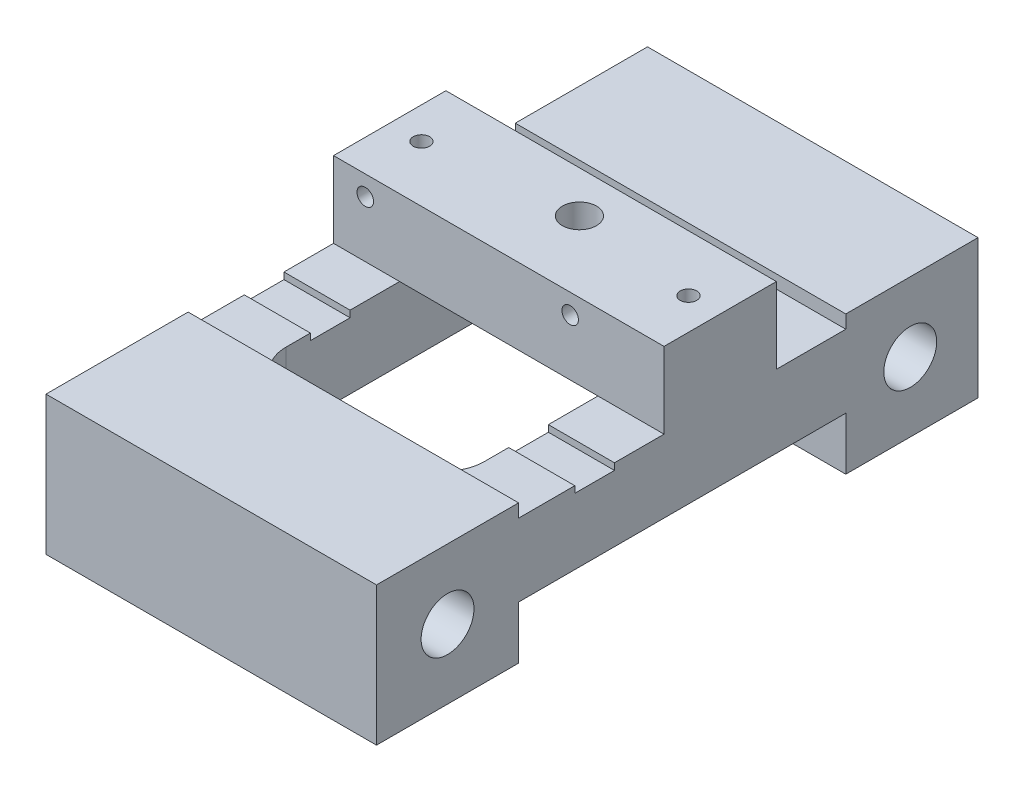
from build123d import *

# Parameters (mm, degrees)
BOSS_EXTRUDE1_DEPTH            = 50
CUT_EXTRUDE1_REACH             = 108.241
M3_TAPPED_HOLE1_D              = 2.5
M3_TAPPED_HOLE2_D              = 2.5
SKETCH7_R                      = 2.577157182
CUT_EXTRUDE2_DEPTH             = 109.218528913
CUT_EXTRUDE3_REACH             = 110.219
SKETCH8_R                      = 4
CUT_EXTRUDE3_DIRECTION_2_DEPTH = 109.218528913


with BuildPart() as part:
    # Sketch1 → Boss-Extrude1 (new body)
    with BuildSketch(Plane(origin=(0, 0, 0), x_dir=(0, 0, -1), z_dir=(1, 0, 0))):
        Polygon((0, 0), (0, 21), (21.5, 21), (21.5, 19), (30, 19), (30, 18), (36, 18), (36, 19), (43.5, 19), (43.5, 30.5), (60.5, 30.5), (60.5, 19), (71, 19), (71, 21), (91, 21), (91, 0), (71, 0), (71, 8), (21.5, 8), (21.5, 0), align=None)
    extrude(amount=BOSS_EXTRUDE1_DEPTH)

    # Cut-Extrude1: up to this face of the body (flat: up to its plane)
    cut_extrude1_end = Plane(part.part.faces().sort_by_distance((25, 19, -65.75))[0])
    # Sketch2 → Cut-Extrude1 (cut, up to the picked face)
    with BuildSketch(Plane(origin=(0, 8, 0), x_dir=(1, 0, 0), z_dir=(0, 1, 0)), mode=Mode.PRIVATE) as cut_extrude1_sk1:
        with BuildLine():
            Line((16, 71.3), (34, 71.3))
            ThreePointArc((34, 71.3), (38.242640687, 69.542640687), (40, 65.3))
            Line((40, 65.3), (40, 26.3))
            ThreePointArc((40, 26.3), (38.242640687, 22.057359313), (34, 20.3))
            Line((34, 20.3), (16, 20.3))
            ThreePointArc((16, 20.3), (11.757359313, 22.057359313), (10, 26.3))
            Line((10, 26.3), (10, 65.3))
            ThreePointArc((10, 65.3), (11.757359313, 69.542640687), (16, 71.3))
        make_face()
    cut_extrude1_tool1 = split(extrude(cut_extrude1_sk1.sketch, amount=CUT_EXTRUDE1_REACH, mode=Mode.PRIVATE), bisect_by=cut_extrude1_end, keep=Keep.BOTH, mode=Mode.PRIVATE)
    add(cut_extrude1_tool1.solids().sort_by(Axis((25, 8, -45.8), (0, 1, 0)))[0], mode=Mode.SUBTRACT)

    # M3 Tapped Hole1 (through all)
    with Locations(Plane(origin=(0, 30.5, 0), x_dir=(1, 0, 0), z_dir=(0, 1, 0))):
        with Locations((4.8, 52), (45.2, 52)):
            Hole(M3_TAPPED_HOLE1_D / 2)

    # M3 Tapped Hole2 (through all)
    with Locations(Plane(origin=(0, 0, -60.5), x_dir=(-1, 0, 0), z_dir=(0, 0, -1))):
        with Locations((-4.8, 27.5), (-35.8, 27.5)):
            Hole(M3_TAPPED_HOLE2_D / 2)

    # Sketch7 → Cut-Extrude2 (cut, through all)
    with BuildSketch(Plane(origin=(0, 30.5, 0), x_dir=(1, 0, 0), z_dir=(0, 1, 0))):
        with Locations(Location((26.5, 54.2, 0), (0, 0, 270))):
            Circle(SKETCH7_R)
    extrude(amount=-CUT_EXTRUDE2_DEPTH, mode=Mode.SUBTRACT)

    # Sketch8 → Cut-Extrude3 (cut, up to next)
    with BuildSketch(Plane(origin=(50, 0, 0), x_dir=(0, 0, -1), z_dir=(1, 0, 0)), mode=Mode.PRIVATE) as cut_extrude3_sk1:
        with Locations(Location((10.75, 10.5, 0), (0, 0, 180))):
            Circle(SKETCH8_R)
    cut_extrude3_tool1 = extrude(cut_extrude3_sk1.sketch, amount=-CUT_EXTRUDE3_REACH, mode=Mode.PRIVATE) & part.part
    # Sketch8 → Cut-Extrude3 (cut, up to next)
    with BuildSketch(Plane(origin=(50, 0, 0), x_dir=(0, 0, -1), z_dir=(1, 0, 0)), mode=Mode.PRIVATE) as cut_extrude3_sk2:
        with Locations(Location((80.75, 10.5, 0), (0, 0, 180))):
            Circle(SKETCH8_R)
    cut_extrude3_tool2 = extrude(cut_extrude3_sk2.sketch, amount=-CUT_EXTRUDE3_REACH, mode=Mode.PRIVATE) & part.part
    add(cut_extrude3_tool1.solids().sort_by_distance((50, 10.5, -10.75))[0], mode=Mode.SUBTRACT)
    add(cut_extrude3_tool2.solids().sort_by_distance((50, 10.5, -80.75))[0], mode=Mode.SUBTRACT)

    # Sketch8 → Cut-Extrude3 direction 2 (cut)
    with BuildSketch(Plane(origin=(50, 0, 0), x_dir=(0, 0, -1), z_dir=(1, 0, 0))):
        with Locations(Location((10.75, 10.5, 0), (0, 0, 180))):
            Circle(SKETCH8_R)
        with Locations(Location((80.75, 10.5, 0), (0, 0, 180))):
            Circle(SKETCH8_R)
    extrude(amount=CUT_EXTRUDE3_DIRECTION_2_DEPTH, mode=Mode.SUBTRACT)


solid = part.part
